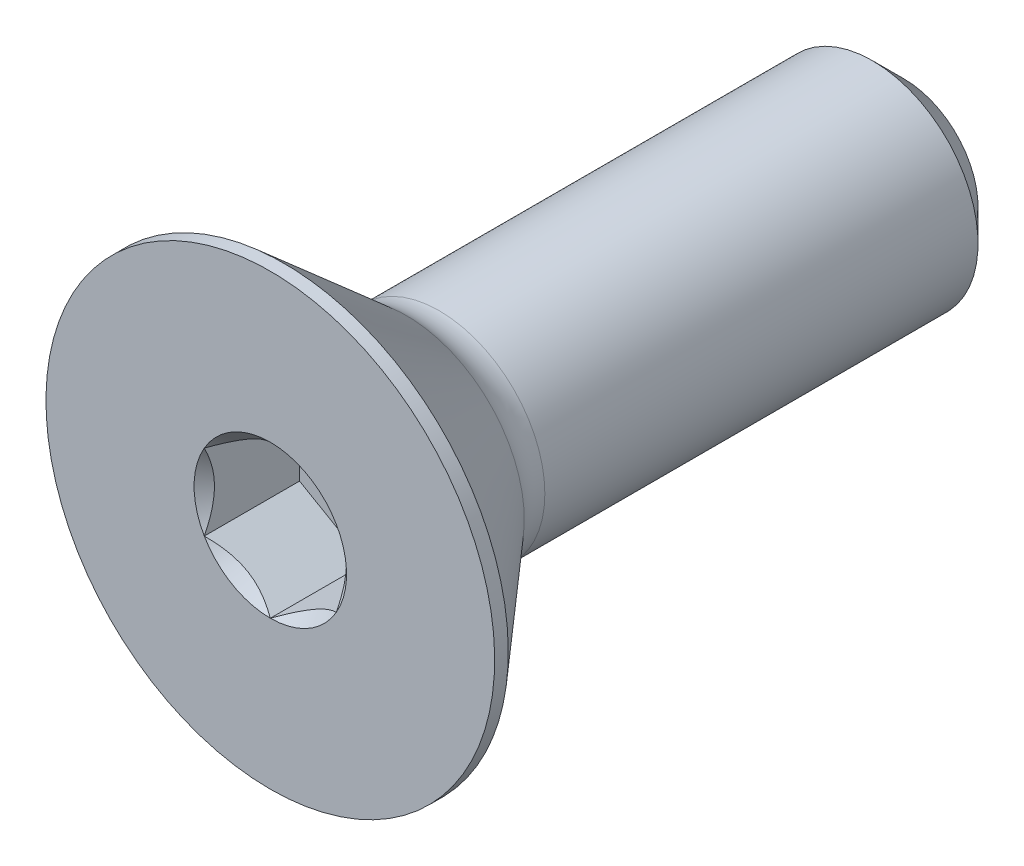
from build123d import *

# Parameters (mm, degrees)
SKETCH1_W          = 19.05
SKETCH1_H          = 3.175
CHAMFER1_SIZE      = 0.9525
CUT_EXTRUDE2_DEPTH = 2.86258


with BuildPart() as part:
    # Sketch1 → Revolve1 (revolve)
    with BuildSketch(Plane(origin=(0, 0, 0), x_dir=(0, 0, -1), z_dir=(1, 0, 0))):
        with Locations((9.525, 1.5875)):
            Rectangle(SKETCH1_W, SKETCH1_H)
    revolve(axis=Axis((0, 0, -19.05), (0, 0, 1)))

    # Chamfer1
    chamfer1_edges = [part.edges().sort_by_distance(p)[0] for p in [
        (0, -3.175, -19.05),
    ]]
    chamfer(chamfer1_edges, length=CHAMFER1_SIZE)


with BuildPart() as body_2:
    # Sketch7 → Revolve2 (revolve)
    with BuildSketch(Plane(origin=(0, 0, 0), x_dir=(0, 0, -1), z_dir=(1, 0, 0)), mode=Mode.PRIVATE) as revolve2_sk:
        with BuildLine():
            Line((0, 6.7437), (0.40894, 6.7437))
            Line((0.40894, 6.7437), (4.0894, 3.544324933))
            ThreePointArc((4.0894, 3.544324933), (4.549909788, 3.270350399), (5.077204404, 3.175))
            Line((5.077204404, 3.175), (5.077204404, 0))
            Line((5.077204404, 0), (0, 0))
            Line((0, 0), (0, 6.7437))
        make_face()
    revolve(revolve2_sk.sketch.rotate(Axis((0, 0, 0), (0, 0, -1)), 180), axis=Axis((0, 0, 0), (0, 0, -1)))

    # Boss-Extrude1 cone 1 section (through the dimple's axis) → Boss-Extrude1 (revolve)
    with BuildSketch(Plane(origin=(0, 0, -5.077204404), x_dir=(0, -1, 0), z_dir=(1, 0, 0))):
        Polygon((0, 0), (3.175, 0), (0, 3.175), align=None)
    revolve(axis=Axis((0, 0, -5.077204404), (0, 0, -1)))

    # Combine1: union part
    add(part.part)

    # Sketch5 → Cut-Extrude2 (cut)
    with BuildSketch(Plane.XY):
        Polygon((1.984375, -1.14567944), (1.984375, 1.14567944), (0, 2.291358881), (-1.984375, 1.14567944), (-1.984375, -1.14567944), (0, -2.291358881), align=None)
    extrude(amount=-CUT_EXTRUDE2_DEPTH, mode=Mode.SUBTRACT)

    # Cut-Extrude3 cone 1 section (through the dimple's axis) → Cut-Extrude3 (revolve, cut)
    with BuildSketch(Plane(origin=(0, 0, 0), x_dir=(0, -1, 0), z_dir=(1, 0, 0))):
        Polygon((0, 0), (2.291358881, 0), (0, 2.291358881), align=None)
    revolve(axis=Axis((0, 0, 0), (0, 0, -1)), mode=Mode.SUBTRACT)


solid = body_2.part
